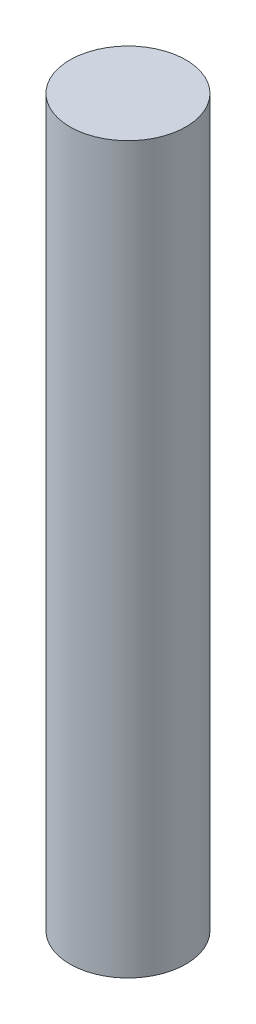
from build123d import *

# Parameters (mm, degrees)
SKETCH_1_R      = 12
EXTRUDE_1_DEPTH = 150


with BuildPart() as part:
    # 草图1 → 凸台-拉伸1 (new body)
    with BuildSketch(Plane(origin=(0, 0, 0), x_dir=(1, 0, 0), z_dir=(0, 1, 0))):
        with Locations(Location((0, 0, 0), (0, 0, 270))):
            Circle(SKETCH_1_R)
    extrude(amount=EXTRUDE_1_DEPTH)


solid = part.part
